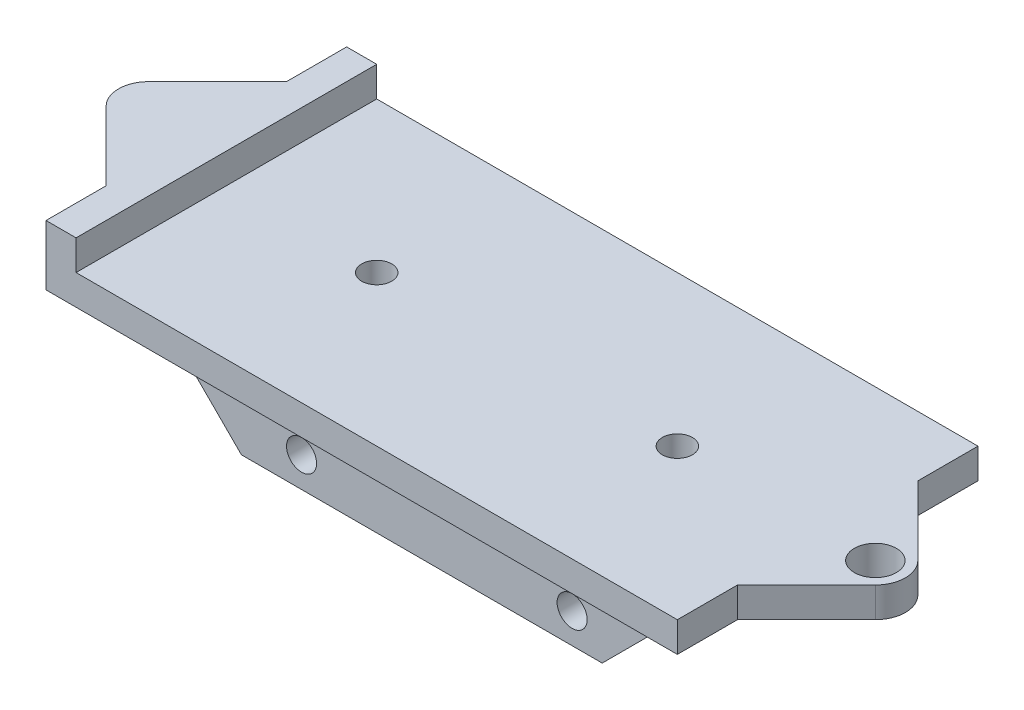
from build123d import *

# Parameters (mm, degrees)
SKETCH1_R           = 3.5
BOSS_EXTRUDE1_DEPTH = 5
BOSS_EXTRUDE2_DEPTH = 5
SKETCH3_R           = 3.5
BOSS_EXTRUDE3_DEPTH = 5
SKETCH4_R           = 2.5
BOSS_EXTRUDE4_DEPTH = 15
CUT_EXTRUDE1_REACH  = 76.469
SKETCH5_W           = 100
SKETCH5_H           = 20
CUT_EXTRUDE2_REACH  = 77.8
SKETCH6_R           = 2.5
CHAMFER1_SIZE       = 1


with BuildPart() as part:
    # Sketch1 → Boss-Extrude1 (new body)
    with BuildSketch(Plane(origin=(0, 0, 0), x_dir=(1, 0, 0), z_dir=(0, 1, 0))):
        with BuildLine():
            Line((50, 15), (61.464466094, 3.535533906))
            ThreePointArc((61.464466094, 3.535533906), (62.928932188, 0), (61.464466094, -3.535533906))
            Line((61.464466094, -3.535533906), (50, -15))
            Line((50, -15), (50, -25))
            Line((50, -25), (-55, -25))
            Line((-55, -25), (-55, 25))
            Line((-55, 25), (50, 25))
            Line((50, 25), (50, 15))
        make_face()
        with Locations(Location((57.928932188, 0, 0), (0, 0, 270))):
            Circle(SKETCH1_R, mode=Mode.SUBTRACT)
    extrude(amount=BOSS_EXTRUDE1_DEPTH)

    # Sketch2 → Boss-Extrude2 (add)
    with BuildSketch(Plane(origin=(0, 5, 0), x_dir=(1, 0, 0), z_dir=(0, 1, 0))):
        with BuildLine():
            Line((-50, 25), (-50, -25))
            Line((-50, -25), (-55, -25))
            Line((-55, -25), (-55, -15))
            Line((-55, -15), (-66.464466094, -3.535533906))
            ThreePointArc((-66.464466094, -3.535533906), (-67.928932188, 0), (-66.464466094, 3.535533906))
            Line((-66.464466094, 3.535533906), (-55, 15))
            Line((-55, 15), (-55, 25))
            Line((-55, 25), (-50, 25))
        make_face()
    extrude(amount=BOSS_EXTRUDE2_DEPTH)

    # Sketch3 → Boss-Extrude3 (add)
    with BuildSketch(Plane.XZ.offset(-5)):
        with Locations(Location((-62.928932188, 0, 0), (0, 0, 270))):
            Circle(SKETCH3_R)
    extrude(amount=BOSS_EXTRUDE3_DEPTH)

    # Sketch4 → Boss-Extrude4 (add, symmetric)
    with BuildSketch(Plane.XY):
        Polygon((-50, 0), (-32.5, -17.5), (27.5, -17.5), (45, 0), align=None)
        with Locations((-22.5, -12.5)):
            Circle(SKETCH4_R, mode=Mode.SUBTRACT)
        with Locations((22.5, -12.5)):
            Circle(SKETCH4_R, mode=Mode.SUBTRACT)
    extrude(amount=BOSS_EXTRUDE4_DEPTH, both=True)

    # Sketch5 → Cut-Extrude1 (cut, up to next)
    with BuildSketch(Plane.XZ, mode=Mode.PRIVATE) as cut_extrude1_sk1:
        Rectangle(SKETCH5_W, SKETCH5_H)
    cut_extrude1_tool1 = extrude(cut_extrude1_sk1.sketch, amount=CUT_EXTRUDE1_REACH, mode=Mode.PRIVATE) & part.part
    add(cut_extrude1_tool1.solids().sort_by_distance((0, 0, 0))[0], mode=Mode.SUBTRACT)

    # Sketch6 → Cut-Extrude2 (cut, up to next)
    with BuildSketch(Plane(origin=(0, 5, 0), x_dir=(1, 0, 0), z_dir=(0, 1, 0)), mode=Mode.PRIVATE) as cut_extrude2_sk1:
        with Locations(Location((25, 0, 0), (0, 0, 270))):
            Circle(SKETCH6_R)
    cut_extrude2_tool1 = extrude(cut_extrude2_sk1.sketch, amount=-CUT_EXTRUDE2_REACH, mode=Mode.PRIVATE) & part.part
    # Sketch6 → Cut-Extrude2 (cut, up to next)
    with BuildSketch(Plane(origin=(0, 5, 0), x_dir=(1, 0, 0), z_dir=(0, 1, 0)), mode=Mode.PRIVATE) as cut_extrude2_sk2:
        with Locations(Location((-25, 0, 0), (0, 0, 270))):
            Circle(SKETCH6_R)
    cut_extrude2_tool2 = extrude(cut_extrude2_sk2.sketch, amount=-CUT_EXTRUDE2_REACH, mode=Mode.PRIVATE) & part.part
    add(cut_extrude2_tool1.solids().sort_by_distance((25, 5, 0))[0], mode=Mode.SUBTRACT)
    add(cut_extrude2_tool2.solids().sort_by_distance((-25, 5, 0))[0], mode=Mode.SUBTRACT)

    # Chamfer1
    chamfer1_edges = [part.edges().sort_by_distance(p)[0] for p in [
        (-62.928932188, 0, 3.5),
    ]]
    chamfer(chamfer1_edges, length=CHAMFER1_SIZE)


solid = part.part
